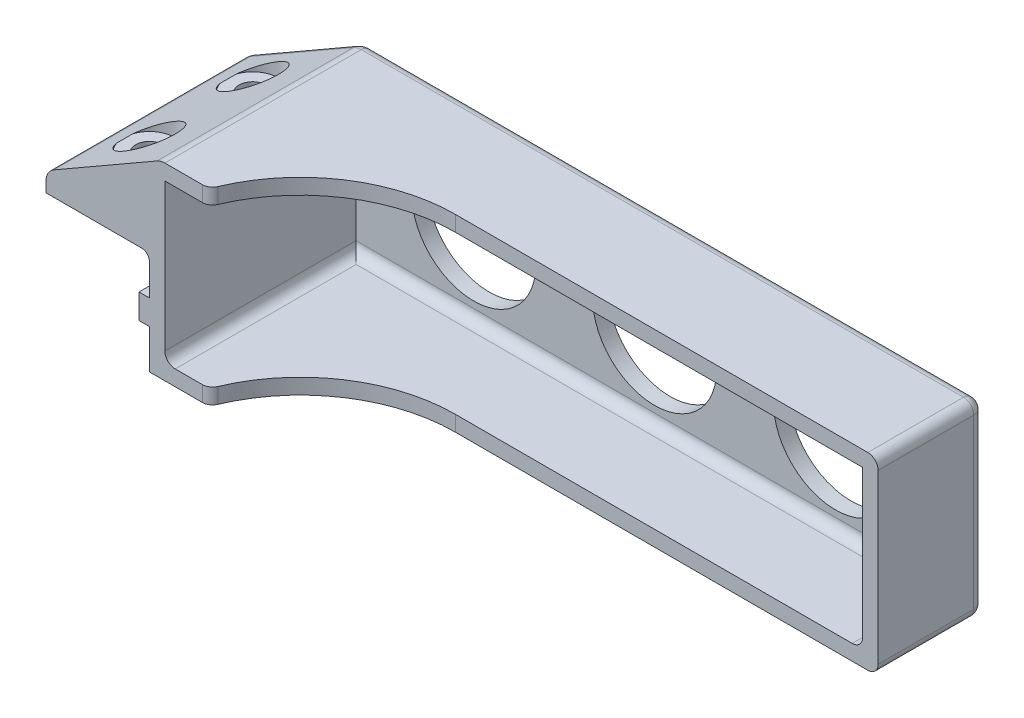
from build123d import *

# Parameters (mm, degrees)
SKETCH1_R                      = 12
BOSS_EXTRUDE1_DEPTH            = 3
BOSS_EXTRUDE2_START            = 37
SKETCH1_3_W                    = 115.5
SKETCH1_3_H                    = 30.5
BOSS_EXTRUDE2_DEPTH            = 37
BOSS_EXTRUDE3_DEPTH            = 33.5
BOSS_EXTRUDE3_DEPTH_BACK       = 3
CBORE_FOR_M5_SHCS1_D           = 5.3
CBORE_FOR_M5_SHCS1_CBORE_D     = 10
CBORE_FOR_M5_SHCS1_CBORE_DEPTH = 9.75
FILLET1_R                      = 2
FILLET2_R                      = 1.5


with BuildPart() as part:
    # Sketch1 → Boss-Extrude1 (new body)
    with BuildSketch(Plane.XY):
        with BuildLine():
            Line((-3, -3), (118.5, -3))
            Line((118.5, -3), (118.5, 33.5))
            Line((118.5, 33.5), (0, 33.5))
            ThreePointArc((0, 33.5), (-0.773900275, 33.398461379), (-1.495413373, 33.100718909))
            Line((-1.495413373, 33.100718909), (-21.495413373, 21.600718909))
            ThreePointArc((-21.495413373, 21.600718909), (-22.596751829, 20.502291563), (-23, 19))
            Line((-23, 19), (-23, 17))
            Line((-23, 17), (-3, 17))
            Line((-3, 17), (-3, 9.4))
            Line((-3, 9.4), (-5, 9.4))
            Line((-5, 9.4), (-5, 4.6))
            Line((-5, 4.6), (-3, 4.6))
            Line((-3, 4.6), (-3, -3))
        make_face()
        with Locations((57.75, 15.25)):
            Circle(SKETCH1_R, mode=Mode.SUBTRACT)
        with Locations((22.75, 15.25)):
            Circle(SKETCH1_R, mode=Mode.SUBTRACT)
        with Locations((92.75, 15.25)):
            Circle(SKETCH1_R, mode=Mode.SUBTRACT)
    extrude(amount=-BOSS_EXTRUDE1_DEPTH)

    # Sketch1<3> → Boss-Extrude2 (add)
    with BuildSketch(Plane.XY.offset(BOSS_EXTRUDE2_START)):
        with BuildLine():
            Line((-3, -3), (118.5, -3))
            Line((118.5, -3), (118.5, 33.5))
            Line((118.5, 33.5), (0, 33.5))
            ThreePointArc((0, 33.5), (-0.773900275, 33.398461379), (-1.495413373, 33.100718909))
            Line((-1.495413373, 33.100718909), (-21.495413373, 21.600718909))
            ThreePointArc((-21.495413373, 21.600718909), (-22.596751829, 20.502291563), (-23, 19))
            Line((-23, 19), (-23, 17))
            Line((-23, 17), (-3, 17))
            Line((-3, 17), (-3, 9.4))
            Line((-3, 9.4), (-5, 9.4))
            Line((-5, 9.4), (-5, 4.6))
            Line((-5, 4.6), (-3, 4.6))
            Line((-3, 4.6), (-3, -3))
        make_face()
        with Locations((57.75, 15.25)):
            Rectangle(SKETCH1_3_W, SKETCH1_3_H, mode=Mode.SUBTRACT)
    extrude(amount=-BOSS_EXTRUDE2_DEPTH)


with BuildPart() as body_2:
    # Sketch2 → Boss-Extrude3 (new, two sides: drawn at the far end of the back side and taken through both)
    with BuildSketch(Plane(origin=(0, 0, 0), x_dir=(1, 0, 0), z_dir=(0, 1, 0)).offset(-BOSS_EXTRUDE3_DEPTH_BACK)):
        with BuildLine():
            Line((-23, -37), (8.597499345, -37))
            ThreePointArc((8.597499345, -37), (19.597359516, -22.852490863), (36.699987142, -17.500008554))
            Line((36.699987142, -17.500008554), (118.5, -17.500008554))
            Line((118.5, -17.500008554), (118.5, 3))
            Line((118.5, 3), (-23, 3))
            Line((-23, 3), (-23, -37))
        make_face()
    extrude(amount=BOSS_EXTRUDE3_DEPTH + BOSS_EXTRUDE3_DEPTH_BACK)


with BuildPart() as part_1:
    add(part.part)

    # Combine1: intersect body 2
    add(body_2.part, mode=Mode.INTERSECT)

    # CBORE for M5 SHCS1 (through all)
    with Locations(Plane(origin=(0, 33.5, 0), x_dir=(1, 0, 0), z_dir=(0, 1, 0))):
        with Locations((-13, -7), (-13, -27)):
            CounterBoreHole(CBORE_FOR_M5_SHCS1_D / 2, CBORE_FOR_M5_SHCS1_CBORE_D / 2, CBORE_FOR_M5_SHCS1_CBORE_DEPTH)

    # Fillet1
    fillet1_edges = [part_1.edges().sort_by_distance(p)[0] for p in [
        (8.597499345, -1.5, 37),
        (115.5, 0, 8.750004277),
        (8.597499345, 32, 37),
        (-23, 18, -3),
        (118.5, 33.5, 7.250004277),
        (118.5, -3, 7.250004277),
        (57.75, -3, -3),
        (118.5, 15.25, -3),
        (0, 0, 18.5),
        (59.25, 33.5, -3),
        (57.75, 0, 0),
        (-0.773900275, 33.398461379, -3),
        (-11.495413373, 27.350718909, -3),
        (-22.596751829, 20.502291563, -3),
    ]]
    fillet(fillet1_edges, radius=FILLET1_R)

    # Fillet2
    fillet2_edges = [part_1.edges().sort_by_distance(p)[0] for p in [
        (-3, 17, 17),
    ]]
    fillet(fillet2_edges, radius=FILLET2_R)


solid = part_1.part
